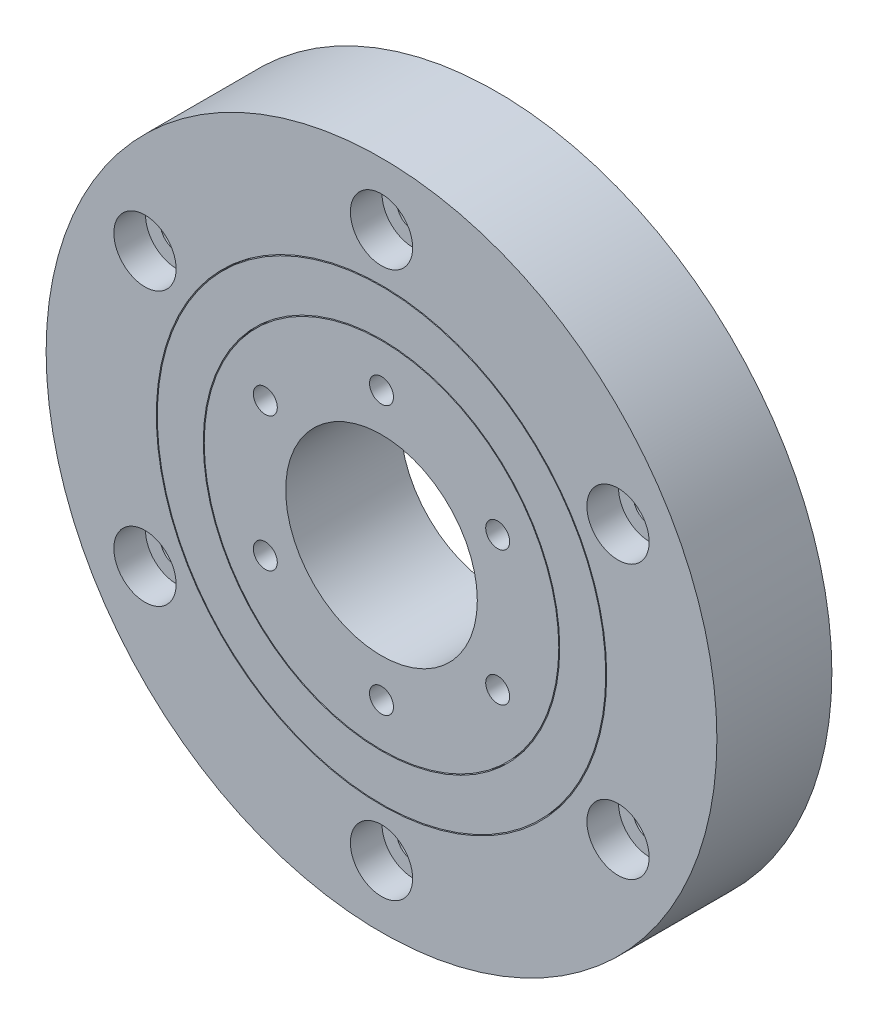
from build123d import *

# Parameters (mm, degrees)
SKETCH_37_20_R            = 18.5
SKETCH_37_20_R_2          = 10
EXTRUDE_37_20_DEPTH       = 12
SKETCH_70_47_R            = 35
SKETCH_70_47_R_2          = 23.5
EXTRUDE_70_47_DEPTH       = 12
M3X0_5_28_2_R             = 1.25
M3X0_5_28_DEPTH           = 12
SKETCH_3_4_57_R           = 1.7
CUT_EXTRUDE_3_4_57_DEPTH  = 12
SKETCH_6_5_3_3_R          = 3.25
CUT_EXTRUDE_6_5_3_3_DEPTH = 3.3
SKETCH_657_R              = 23.4
SKETCH_657_R_2            = 18.6
EXTRUDE_669_DEPTH         = 0.5
SKETCH_700_R              = 23.4
SKETCH_700_R_2            = 18.6
EXTRUDE_807_DEPTH         = 0.5


with BuildPart() as part:
    # 内圈_轴肩Ø37_内孔Ø20_草图 → 内圈_轴肩Ø37_内孔Ø20 (new body)
    with BuildSketch(Plane.XY):
        Circle(SKETCH_37_20_R)
        Circle(SKETCH_37_20_R_2, mode=Mode.SUBTRACT)
    extrude(amount=EXTRUDE_37_20_DEPTH)

    # M3x0.5__28 2 → M3x0.5__28 (cut)
    with BuildSketch(Plane.XY.offset(12)):
        with Locations((12.124355653, 7)):
            Circle(M3X0_5_28_2_R)
        with Locations((0, 14)):
            Circle(M3X0_5_28_2_R)
        with Locations((-12.124355653, 7)):
            Circle(M3X0_5_28_2_R)
        with Locations((-12.124355653, -7)):
            Circle(M3X0_5_28_2_R)
        with Locations((0, -14)):
            Circle(M3X0_5_28_2_R)
        with Locations((12.124355653, -7)):
            Circle(M3X0_5_28_2_R)
    extrude(amount=-M3X0_5_28_DEPTH, mode=Mode.SUBTRACT)


with BuildPart() as body_2:
    # 外圈_外径Ø70_轴肩Ø47_草图 → 外圈_外径Ø70_轴肩Ø47 (new body)
    with BuildSketch(Plane.XY):
        Circle(SKETCH_70_47_R)
        Circle(SKETCH_70_47_R_2, mode=Mode.SUBTRACT)
    extrude(amount=EXTRUDE_70_47_DEPTH)

    # 外圈_六处Ø3.4通孔_分度圆Ø57_草图 → 外圈_六处Ø3.4通孔_分度圆Ø57 (cut)
    with BuildSketch(Plane.XY.offset(12)):
        with Locations((24.681724008, 14.25)):
            Circle(SKETCH_3_4_57_R)
        with Locations((0, 28.5)):
            Circle(SKETCH_3_4_57_R)
        with Locations((-24.681724008, 14.25)):
            Circle(SKETCH_3_4_57_R)
        with Locations((-24.681724008, -14.25)):
            Circle(SKETCH_3_4_57_R)
        with Locations((0, -28.5)):
            Circle(SKETCH_3_4_57_R)
        with Locations((24.681724008, -14.25)):
            Circle(SKETCH_3_4_57_R)
    extrude(amount=-CUT_EXTRUDE_3_4_57_DEPTH, mode=Mode.SUBTRACT)

    # 外圈_六处Ø6.5沉孔_深3.3_草图 → 外圈_六处Ø6.5沉孔_深3.3 (cut)
    with BuildSketch(Plane.XY.offset(12)):
        with Locations((24.681724008, 14.25)):
            Circle(SKETCH_6_5_3_3_R)
        with Locations((0, 28.5)):
            Circle(SKETCH_6_5_3_3_R)
        with Locations((-24.681724008, 14.25)):
            Circle(SKETCH_6_5_3_3_R)
        with Locations((-24.681724008, -14.25)):
            Circle(SKETCH_6_5_3_3_R)
        with Locations((0, -28.5)):
            Circle(SKETCH_6_5_3_3_R)
        with Locations((24.681724008, -14.25)):
            Circle(SKETCH_6_5_3_3_R)
    extrude(amount=-CUT_EXTRUDE_6_5_3_3_DEPTH, mode=Mode.SUBTRACT)


with BuildPart() as body_3:
    # Sketch 657 → Extrude 669 (new body)
    with BuildSketch(Plane.XY):
        Circle(SKETCH_657_R)
        Circle(SKETCH_657_R_2, mode=Mode.SUBTRACT)
    extrude(amount=EXTRUDE_669_DEPTH)


with BuildPart() as body_4:
    # Sketch 700 → Extrude 807 (new body)
    with BuildSketch(Plane.XY.offset(12)):
        Circle(SKETCH_700_R)
        Circle(SKETCH_700_R_2, mode=Mode.SUBTRACT)
    extrude(amount=-EXTRUDE_807_DEPTH)


solid = Compound([part.part, body_2.part, body_3.part, body_4.part])
